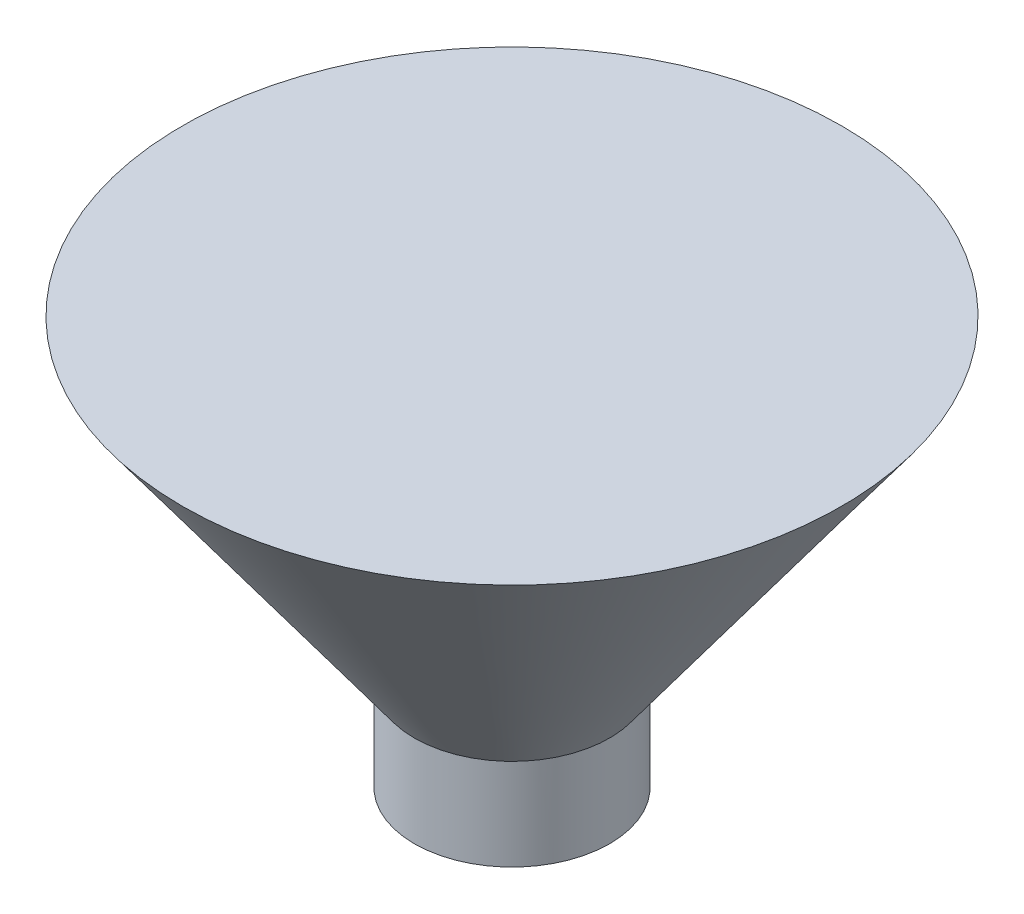
from build123d import *

# Parameters (mm, degrees)
SKETCH2_R           = 16
BOSS_EXTRUDE1_DEPTH = 15


with BuildPart() as part:
    # Sketch1 → Revolve1 (revolve)
    with BuildSketch(Plane.XY, mode=Mode.PRIVATE) as revolve1_sk:
        Polygon((0, 0), (16, 0), (54, 51.88954715), (0, 51.88954715), align=None)
    revolve(revolve1_sk.sketch.rotate(Axis((0, -12.448515581, 0), (0, 1, 0)), 270), axis=Axis((0, -12.448515581, 0), (0, 1, 0)))

    # Sketch2 → Boss-Extrude1 (add)
    with BuildSketch(Plane.XZ):
        with Locations(Location((0, 0, 0), (0, 0, 90))):
            Circle(SKETCH2_R)
    extrude(amount=BOSS_EXTRUDE1_DEPTH)


solid = part.part
